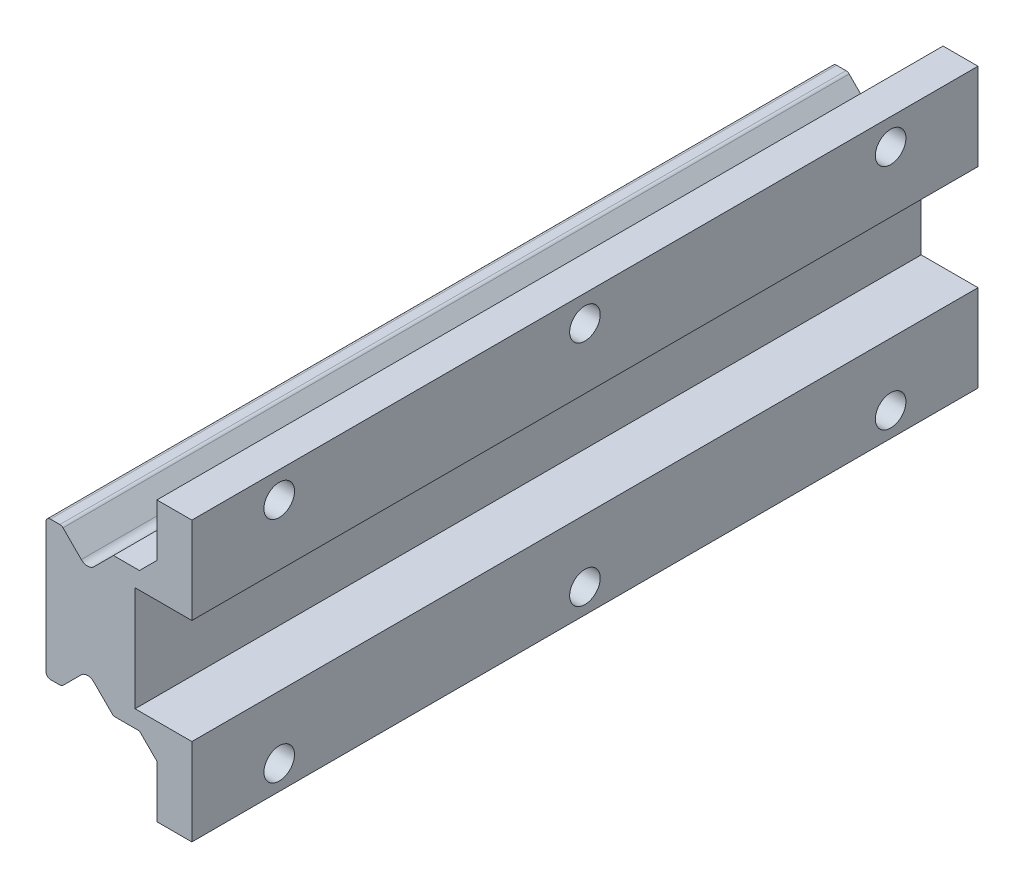
from build123d import *

# Parameters (mm, degrees)
BOSS_EXTRUDE1_DEPTH      = 90
CUT_EXTRUDE_3_DEPTH      = 96.450944476
CUT_EXTRUDE_3_DEPTH_BACK = 96.450944476
SKETCH_1_R               = 1.75


with BuildPart() as part:
    # Sketch3 → Boss-Extrude1 (new body)
    with BuildSketch(Plane.XY):
        with BuildLine():
            ThreePointArc((28.391540767, 5.745528826), (28.540330522, 5.386318581), (28.899540767, 5.237528826))
            Line((28.899540767, 5.237528826), (29.981834767, 5.237528826))
            ThreePointArc((29.981834767, 5.237528826), (30.17623795, 5.276198023), (30.341045012, 5.386318581))
            Line((30.341045012, 5.386318581), (32.435619517, 7.480893087))
            ThreePointArc((32.435619517, 7.480893087), (33.154438301, 7.774195584), (33.870518646, 7.474269363))
            Line((33.870518646, 7.474269363), (36.110112773, 5.234675237))
            Line((36.110112773, 5.234675237), (39.091540767, 5.234675237))
            Line((39.091540767, 5.234675237), (41.08974786, 3.234676041))
            Line((41.08974786, 3.234676041), (41.084369139, -2.765323955))
            Line((41.084369139, -2.765323955), (45.091540767, -2.765323955))
            Line((45.091540767, -2.765323955), (45.091540767, 7.191225138))
            Line((45.091540767, 7.191225138), (41.088844083, 7.191225138))
            Line((41.088844083, 7.191225138), (38.591540767, 7.191225138))
            Line((38.591540767, 7.191225138), (38.591540767, 19.191225138))
            Line((38.591540767, 19.191225138), (41.091540767, 19.191225138))
            Line((41.091540767, 19.191225138), (45.091540767, 19.191225138))
            Line((45.091540767, 19.191225138), (45.091540767, 29.147775237))
            Line((45.091540767, 29.147775237), (41.091540767, 29.147775237))
            Line((41.091540767, 29.147775237), (41.091540767, 23.147775237))
            Line((41.091540767, 23.147775237), (39.091540767, 21.147775237))
            Line((39.091540767, 21.147775237), (36.112970002, 21.147775237))
            Line((36.112970002, 21.147775237), (33.873375875, 18.908181111))
            ThreePointArc((33.873375875, 18.908181111), (33.154687691, 18.609685261), (32.435619517, 18.907264564))
            Line((32.435619517, 18.907264564), (30.341045012, 21.00183907))
            ThreePointArc((30.341045012, 21.00183907), (30.17623795, 21.111959628), (29.981834767, 21.150628826))
            Line((29.981834767, 21.150628826), (28.899540767, 21.150628826))
            ThreePointArc((28.899540767, 21.150628826), (28.540330522, 21.00183907), (28.391540767, 20.642628826))
            Line((28.391540767, 20.642628826), (28.391540767, 5.745528826))
        make_face()
    extrude(amount=BOSS_EXTRUDE1_DEPTH)

    # Эскиз1 → Вырез-Вытянуть3 (cut, two sides: drawn at the far end of the back side and taken through both)
    with BuildSketch(Plane.ZY.offset(-41.091540767).offset(-CUT_EXTRUDE_3_DEPTH_BACK)):
        with Locations(Location((10, 0.026075116, 0), (0, 0, 270))):
            Circle(SKETCH_1_R)
        with Locations(Location((45, 0.026075116, 0), (0, 0, 270))):
            Circle(SKETCH_1_R)
        with Locations(Location((80, 0.026075116, 0), (0, 0, 270))):
            Circle(SKETCH_1_R)
        with Locations(Location((45, 26.147775237, 0), (0, 0, 270))):
            Circle(SKETCH_1_R)
        with Locations(Location((80, 26.147775237, 0), (0, 0, 270))):
            Circle(SKETCH_1_R)
        with Locations(Location((10, 26.147775237, 0), (0, 0, 270))):
            Circle(SKETCH_1_R)
    extrude(amount=CUT_EXTRUDE_3_DEPTH + CUT_EXTRUDE_3_DEPTH_BACK, mode=Mode.SUBTRACT)


solid = part.part
